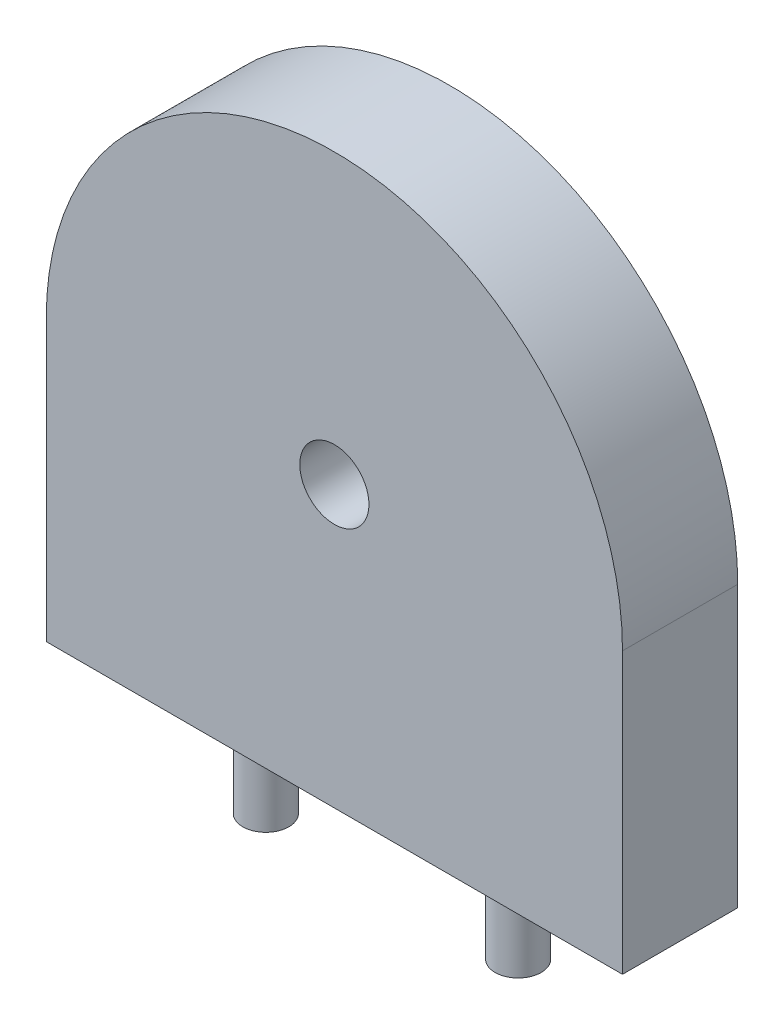
from build123d import *

# Parameters (mm, degrees)
ESQUISSE1_R             = 3
BOSS_EXTRU_1_DEPTH      = 10
ESQUISSE2_R             = 2
BOSS_EXTRU_2_DEPTH      = 8
ESQUISSE6_W             = 50
ESQUISSE6_H             = 0.42
BOSS_EXTRU_4_DEPTH      = 10
ESQUISSE7_W             = 50
ESQUISSE7_H             = 0.81
ENL_V_MAT_EXTRU_3_DEPTH = 10
ESQUISSE8_R             = 2
BOSS_EXTRU_5_DEPTH      = 8.39


with BuildPart() as part:
    # Esquisse1 → Boss.-Extru.1 (new body)
    with BuildSketch(Plane.XY):
        with BuildLine():
            Line((-25, -12.35), (25, -12.35))
            Line((25, -12.35), (25, 12.35))
            ThreePointArc((25, 12.35), (0, 37.35), (-25, 12.35))
            Line((-25, 12.35), (-25, -12.35))
        make_face()
        with Locations((0, 12.35)):
            Circle(ESQUISSE1_R, mode=Mode.SUBTRACT)
    extrude(amount=BOSS_EXTRU_1_DEPTH)

    # Esquisse2 → Boss.-Extru.2 (add)
    with BuildSketch(Plane.XZ.offset(12.35)):
        with Locations(Location((-10.94600496, 5, 0), (0, 0, 90))):
            Circle(ESQUISSE2_R)
        with Locations(Location((10.94600496, 5, 0), (0, 0, 90))):
            Circle(ESQUISSE2_R)
    extrude(amount=BOSS_EXTRU_2_DEPTH)

    # Esquisse6 → Boss.-Extru.4 (add)
    with BuildSketch(Plane.XY.offset(10)):
        with Locations((0, -12.56)):
            Rectangle(ESQUISSE6_W, ESQUISSE6_H)
    extrude(amount=-BOSS_EXTRU_4_DEPTH)

    # Esquisse7 → Enlèv. mat.-Extru.3 (cut)
    with BuildSketch(Plane.XY.offset(10)):
        with Locations((0, -12.365)):
            Rectangle(ESQUISSE7_W, ESQUISSE7_H)
    extrude(amount=-ENL_V_MAT_EXTRU_3_DEPTH, mode=Mode.SUBTRACT)


with BuildPart() as enl_v_mat_extru_3_piece_1:
    # of the separate pieces the step leaves, piece 1, a body of its own (enl_v_mat_extru_3_pieces)
    add(part.part.solids().sort_by_distance((-25, 12.35, 0))[0])



with BuildPart() as enl_v_mat_extru_3_piece_2:
    # of the separate pieces the step leaves, piece 2, a body of its own (enl_v_mat_extru_3_pieces)
    add(part.part.solids().sort_by_distance((-10.94600496, -12.77, 7))[0])


with BuildPart() as enl_v_mat_extru_3_piece_3:
    # of the separate pieces the step leaves, piece 3, a body of its own (enl_v_mat_extru_3_pieces)
    add(part.part.solids().sort_by_distance((10.94600496, -12.77, 7))[0])


with BuildPart() as enl_v_mat_extru_3_piece_1_1:
    add(enl_v_mat_extru_3_piece_1.part)

    add(enl_v_mat_extru_3_piece_2.part)  # Boss.-Extru.5 merges Enlèv. mat.-Extru.3 piece 2

    add(enl_v_mat_extru_3_piece_3.part)  # Boss.-Extru.5 merges Enlèv. mat.-Extru.3 piece 3
    # Esquisse8 → Boss.-Extru.5 (add)
    with BuildSketch(Plane.XZ.offset(11.96)):
        with Locations(Location((-10.94600496, 5, 0), (0, 0, 90))):
            Circle(ESQUISSE8_R)
        with Locations(Location((10.94600496, 5, 0), (0, 0, 90))):
            Circle(ESQUISSE8_R)
    extrude(amount=BOSS_EXTRU_5_DEPTH)


solid = enl_v_mat_extru_3_piece_1_1.part
